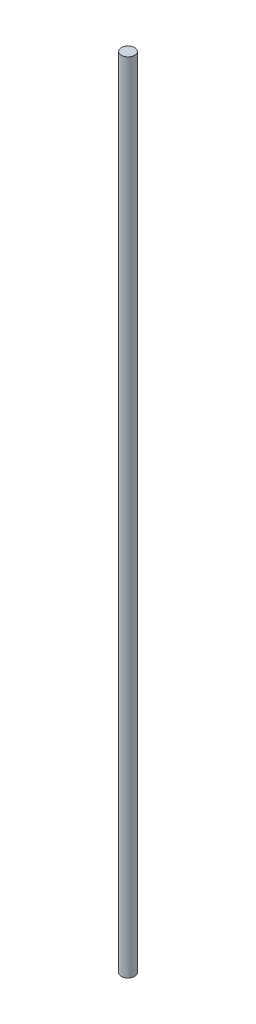
from build123d import *

# Parameters (mm, degrees)
SKETCH1_R           = 5
BOSS_EXTRUDE1_DEPTH = 600


with BuildPart() as part:
    # Sketch1 → Boss-Extrude1 (new body)
    with BuildSketch(Plane(origin=(0, 0, 0), x_dir=(1, 0, 0), z_dir=(0, 1, 0))):
        with Locations(Location((0, 0, 0), (0, 0, 270))):
            Circle(SKETCH1_R)
    extrude(amount=BOSS_EXTRUDE1_DEPTH)


solid = part.part
